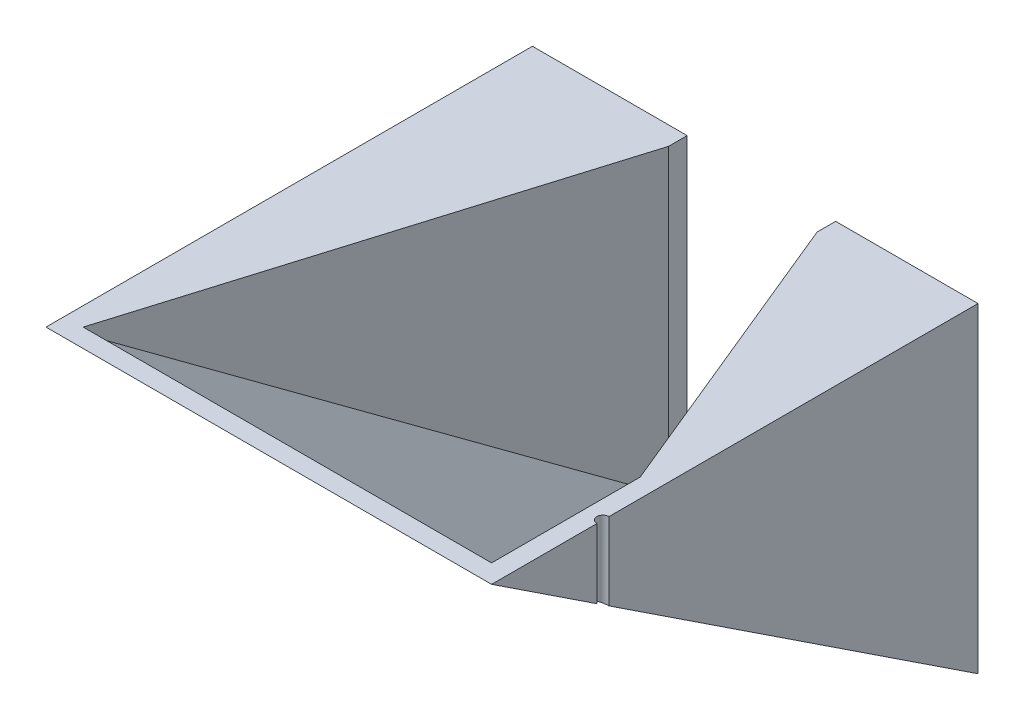
from build123d import *

# Parameters (mm, degrees)
BOSS_EXTRUDE3_DEPTH      = 60
CUT_EXTRUDE1_REACH       = 100.764
SKETCH8_W                = 55
SKETCH8_H                = 60.5
BOSS_EXTRUDE4_DEPTH      = 56
BOSS_EXTRUDE7_REACH      = 100.764
SKETCH13_W               = 20
SKETCH13_H               = 40.707899827
CUT_EXTRUDE7_DEPTH       = 3
CUT_EXTRUDE10_DEPTH      = 99.7643787
CUT_EXTRUDE10_DEPTH_BACK = 99.7643787
SKETCH18_R               = 0.815


with BuildPart() as part:
    # Sketch6 → Boss-Extrude3 (new body)
    with BuildSketch(Plane(origin=(0, 0, 0), x_dir=(0, 0, -1), z_dir=(1, 0, 0))):
        Polygon((0, 0), (65.5, 0), (65.5, -43.17583236), align=None)
    extrude(amount=BOSS_EXTRUDE3_DEPTH)

    # Cut-Extrude1: up to this plane
    cut_extrude1_end = Plane(origin=(60, -43.17583236, -65.5), z_dir=(0, 0.8349267049075845, -0.5503611518195697))
    # Sketch8 → Cut-Extrude1 (cut, up to the surface)
    with BuildSketch(Plane(origin=(0, 0, 0), x_dir=(1, 0, 0), z_dir=(0, 1, 0)), mode=Mode.PRIVATE) as cut_extrude1_sk1:
        with Locations((30, 32.75)):
            Rectangle(SKETCH8_W, SKETCH8_H)
    cut_extrude1_tool1 = split(extrude(cut_extrude1_sk1.sketch, amount=-CUT_EXTRUDE1_REACH, mode=Mode.PRIVATE), bisect_by=cut_extrude1_end, keep=Keep.BOTH, mode=Mode.PRIVATE)
    add(cut_extrude1_tool1.solids().sort_by_distance((30, 0, -32.75))[0], mode=Mode.SUBTRACT)

    # Sketch9 → Boss-Extrude4 (add)
    with BuildSketch(Plane(origin=(2.5, 0, 0), x_dir=(0, 0, -1), z_dir=(1, 0, 0))):
        Polygon((2.5, -1.647932533), (2.5, -0.823966266), (63, -40.707899827), (63, -41.527899827), align=None)
    extrude(amount=BOSS_EXTRUDE4_DEPTH)

    # Boss-Extrude7: up to this plane
    boss_extrude7_end = Plane(origin=(58.5, -0.823966266, -2.5), z_dir=(0, -0.8349015528826996, 0.5503993068618971))
    # Sketch11 → Boss-Extrude7 (add, up to the surface)
    with BuildSketch(Plane(origin=(0, 0, 0), x_dir=(1, 0, 0), z_dir=(0, 1, 0)), mode=Mode.PRIVATE) as boss_extrude7_sk1:
        Polygon((57.5, 63), (57.5, 22.5), (40.834621514, 63), align=None)
    boss_extrude7_tool1 = split(extrude(boss_extrude7_sk1.sketch, amount=-BOSS_EXTRUDE7_REACH, mode=Mode.PRIVATE), bisect_by=boss_extrude7_end, keep=Keep.BOTH, mode=Mode.PRIVATE)
    add(boss_extrude7_tool1.solids().sort_by_distance((51.944874, 0, -49.5))[0])
    # Sketch11 → Boss-Extrude7 (add, up to the surface)
    with BuildSketch(Plane(origin=(0, 0, 0), x_dir=(1, 0, 0), z_dir=(0, 1, 0)), mode=Mode.PRIVATE) as boss_extrude7_sk2:
        Polygon((2.5, 63), (2.5, 2.5), (20.834621514, 63), align=None)
    boss_extrude7_tool2 = split(extrude(boss_extrude7_sk2.sketch, amount=-BOSS_EXTRUDE7_REACH, mode=Mode.PRIVATE), bisect_by=boss_extrude7_end, keep=Keep.BOTH, mode=Mode.PRIVATE)
    add(boss_extrude7_tool2.solids().sort_by_distance((8.611541, 0, -42.833333))[0])

    # Sketch13 → Cut-Extrude7 (cut)
    with BuildSketch(Plane.XY.offset(-63)):
        with Locations((30.834621514, -20.353949914)):
            Rectangle(SKETCH13_W, SKETCH13_H)
    extrude(amount=-CUT_EXTRUDE7_DEPTH, mode=Mode.SUBTRACT)

    # Sketch18 → Cut-Extrude10 (cut, two sides: drawn at the far end of the back side and taken through both)
    with BuildSketch(Plane(origin=(0, 0, 0), x_dir=(1, 0, 0), z_dir=(0, 1, 0)).offset(-CUT_EXTRUDE10_DEPTH_BACK)):
        with Locations((60, 15)):
            Circle(SKETCH18_R)
    extrude(amount=CUT_EXTRUDE10_DEPTH + CUT_EXTRUDE10_DEPTH_BACK, mode=Mode.SUBTRACT)


solid = part.part
